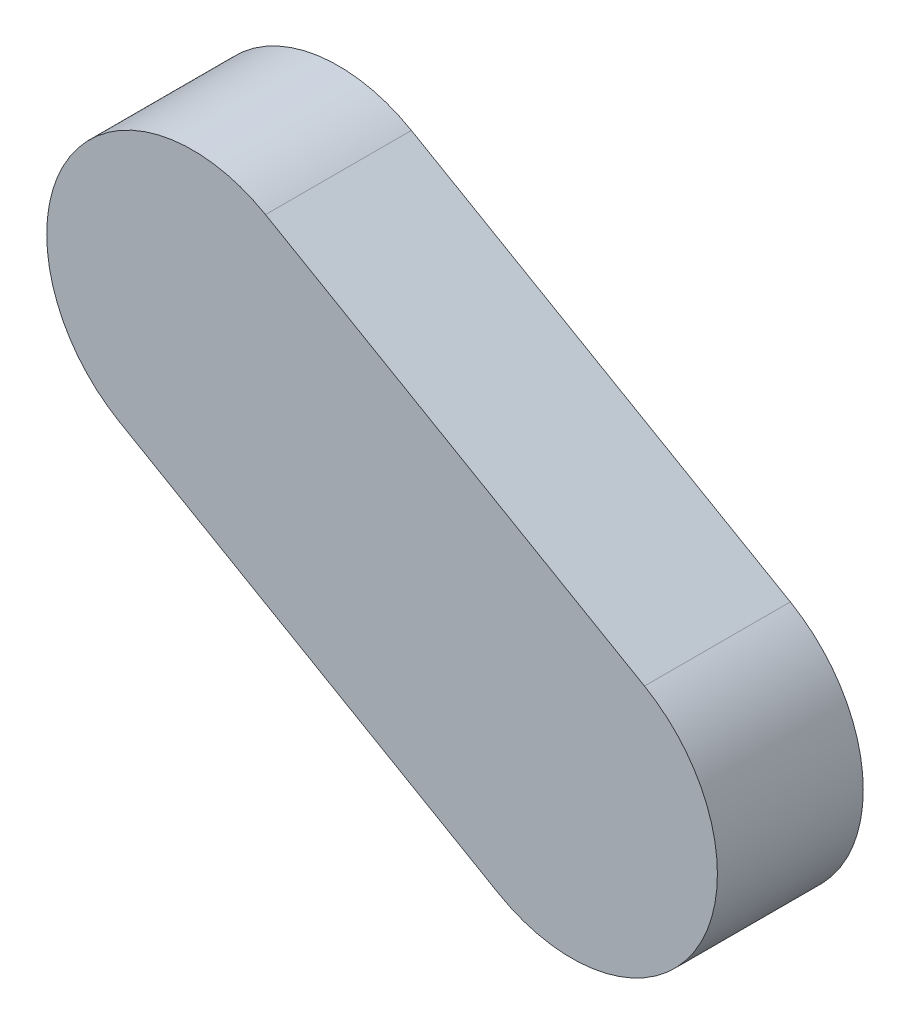
from build123d import *

# Parameters (mm, degrees)
SALIENTE_EXTRUIR2_DEPTH = 10


with BuildPart() as part:
    # Croquis1 → Saliente-Extruir2 (new body)
    with BuildSketch(Plane.XY):
        with BuildLine():
            Line((-20.980762114, 23.660254038), (5, 8.660254038))
            ThreePointArc((5, 8.660254038), (8.660254038, -5), (-5, -8.660254038))
            Line((-5, -8.660254038), (-30.980762114, 6.339745962))
            ThreePointArc((-30.980762114, 6.339745962), (-34.641016151, 20), (-20.980762114, 23.660254038))
        make_face()
    extrude(amount=SALIENTE_EXTRUIR2_DEPTH)


solid = part.part
